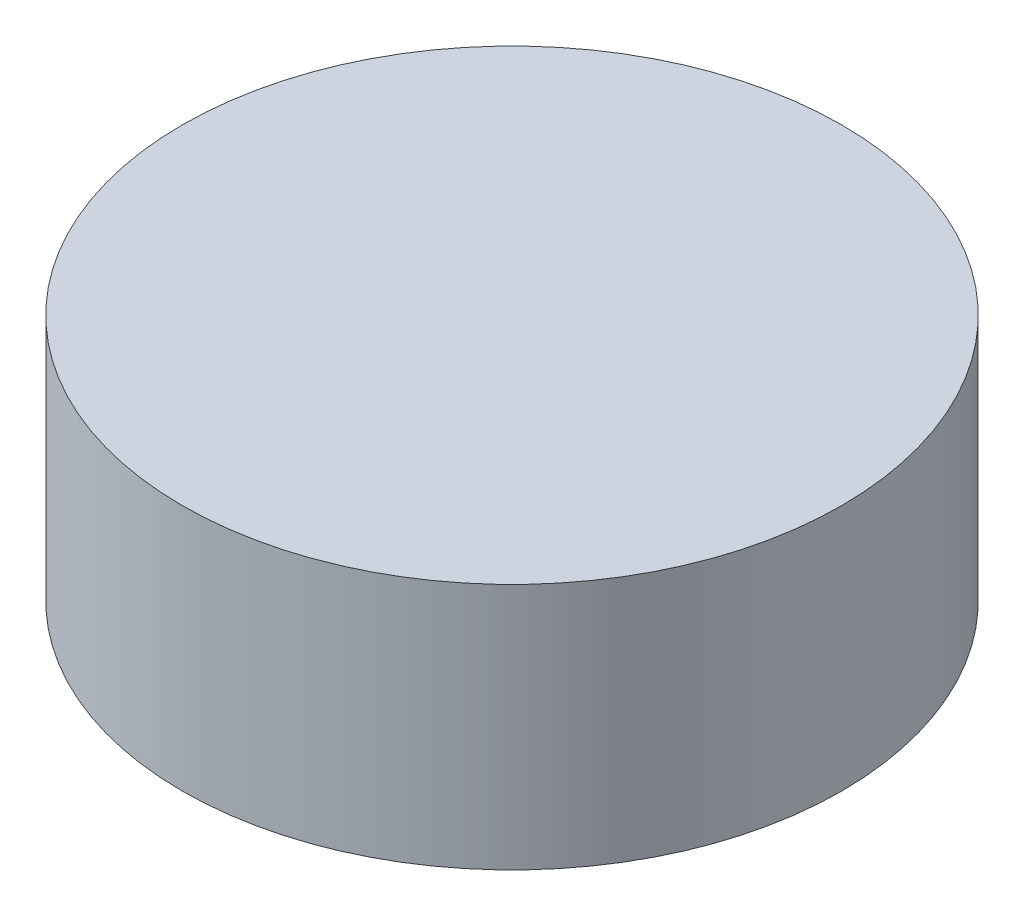
from build123d import *

# Parameters (mm, degrees)
SKETCH2_R                 = 50.8
BOSS_EXTRUDE1_DEPTH       = 38.1
FUEL_D                    = 1.016
FUEL_DEPTH                = 25.4
FUELPATTERN_COPY_1_D      = 1.016
FUELPATTERN_COPY_1_DEPTH  = 25.4
FUELPATTERN_COPY_2_D      = 1.016
FUELPATTERN_COPY_2_DEPTH  = 25.4
FUELPATTERN_COPY_3_D      = 1.016
FUELPATTERN_COPY_3_DEPTH  = 25.4
FUELPATTERN_COPY_4_D      = 1.016
FUELPATTERN_COPY_4_DEPTH  = 25.4
FUELPATTERN_COPY_5_D      = 1.016
FUELPATTERN_COPY_5_DEPTH  = 25.4
FUELPATTERN_COPY_6_D      = 1.016
FUELPATTERN_COPY_6_DEPTH  = 25.4
FUELPATTERN_COPY_7_D      = 1.016
FUELPATTERN_COPY_7_DEPTH  = 25.4
FUELPATTERN_COPY_8_D      = 1.016
FUELPATTERN_COPY_8_DEPTH  = 25.4
FUELPATTERN_COPY_9_D      = 1.016
FUELPATTERN_COPY_9_DEPTH  = 25.4
FUELPATTERN_COPY_10_D     = 1.016
FUELPATTERN_COPY_10_DEPTH = 25.4
OX_D                      = 1.016
OX_DEPTH                  = 25.4
OXPATTERN_COPY_1_D        = 1.016
OXPATTERN_COPY_1_DEPTH    = 25.4
OXPATTERN_COPY_2_D        = 1.016
OXPATTERN_COPY_2_DEPTH    = 25.4
OXPATTERN_COPY_3_D        = 1.016
OXPATTERN_COPY_3_DEPTH    = 25.4
OXPATTERN_COPY_4_D        = 1.016
OXPATTERN_COPY_4_DEPTH    = 25.4
OXPATTERN_COPY_5_D        = 1.016
OXPATTERN_COPY_5_DEPTH    = 25.4
OXPATTERN_COPY_6_D        = 1.016
OXPATTERN_COPY_6_DEPTH    = 25.4


with BuildPart() as part:
    # Sketch2 → Boss-Extrude1 (new body)
    with BuildSketch(Plane(origin=(0, 0, 0), x_dir=(1, 0, 0), z_dir=(0, 1, 0))):
        Circle(SKETCH2_R)
    extrude(amount=BOSS_EXTRUDE1_DEPTH)

    # Fuel
    with Locations(Plane(origin=(0, 0, 0), x_dir=(0, 0, -1), z_dir=(-0.7071067811865488, -0.7071067811865464, 0))):
        with Locations((-38.1, 4.490128061)):
            fuel = Hole(FUEL_D / 2, depth=FUEL_DEPTH)

    # FuelMirror: Fuel across plane
    add(fuel.mirror(Plane(origin=(0, 0, 0), x_dir=(0, 0, 1), z_dir=(1, 0, 0))), mode=Mode.SUBTRACT)

    # FuelPattern copy 1
    with Locations(Plane(origin=(0, 0, 0), x_dir=(-0.8660254037844386, 0, -0.5000000000000001), z_dir=(0.35355339059327445, -0.7071067811865464, -0.6123724356957956))):
        with Locations((-38.1, -4.490128061)):
            Hole(FUELPATTERN_COPY_1_D / 2, depth=FUELPATTERN_COPY_1_DEPTH)

    # FuelPattern copy 2
    with Locations(Plane(origin=(0, 0, 0), x_dir=(-0.8660254037844387, 0, 0.4999999999999998), z_dir=(-0.35355339059327423, -0.7071067811865464, -0.6123724356957957))):
        with Locations((-38.1, -4.490128061)):
            Hole(FUELPATTERN_COPY_2_D / 2, depth=FUELPATTERN_COPY_2_DEPTH)

    # FuelPattern copy 3
    with Locations(Plane(origin=(0, 0, 0), x_dir=(0, 0, 1), z_dir=(-0.7071067811865488, -0.7071067811865464, 0))):
        with Locations((-38.1, -4.490128061)):
            Hole(FUELPATTERN_COPY_3_D / 2, depth=FUELPATTERN_COPY_3_DEPTH)

    # FuelPattern copy 4
    with Locations(Plane(origin=(0, 0, 0), x_dir=(0.8660254037844384, 0, 0.5000000000000004), z_dir=(-0.35355339059327473, -0.7071067811865464, 0.6123724356957955))):
        with Locations((-38.1, -4.490128061)):
            Hole(FUELPATTERN_COPY_4_D / 2, depth=FUELPATTERN_COPY_4_DEPTH)

    # FuelPattern copy 5
    with Locations(Plane(origin=(0, 0, 0), x_dir=(0.8660254037844386, 0, -0.5000000000000001), z_dir=(0.35355339059327445, -0.7071067811865464, 0.6123724356957956))):
        with Locations((-38.1, -4.490128061)):
            Hole(FUELPATTERN_COPY_5_D / 2, depth=FUELPATTERN_COPY_5_DEPTH)

    # FuelPattern copy 6
    with Locations(Plane(origin=(0, 0, 0), x_dir=(-0.8660254037844386, 0, -0.5000000000000001), z_dir=(-0.35355339059327445, -0.7071067811865464, 0.6123724356957956))):
        with Locations((-38.1, 4.490128061)):
            Hole(FUELPATTERN_COPY_6_D / 2, depth=FUELPATTERN_COPY_6_DEPTH)

    # FuelPattern copy 7
    with Locations(Plane(origin=(0, 0, 0), x_dir=(-0.8660254037844387, 0, 0.4999999999999998), z_dir=(0.35355339059327423, -0.7071067811865464, 0.6123724356957957))):
        with Locations((-38.1, 4.490128061)):
            Hole(FUELPATTERN_COPY_7_D / 2, depth=FUELPATTERN_COPY_7_DEPTH)

    # FuelPattern copy 8
    with Locations(Plane(origin=(0, 0, 0), x_dir=(0, 0, 1), z_dir=(0.7071067811865488, -0.7071067811865464, 0))):
        with Locations((-38.1, 4.490128061)):
            Hole(FUELPATTERN_COPY_8_D / 2, depth=FUELPATTERN_COPY_8_DEPTH)

    # FuelPattern copy 9
    with Locations(Plane(origin=(0, 0, 0), x_dir=(0.8660254037844384, 0, 0.5000000000000004), z_dir=(0.35355339059327473, -0.7071067811865464, -0.6123724356957955))):
        with Locations((-38.1, 4.490128061)):
            Hole(FUELPATTERN_COPY_9_D / 2, depth=FUELPATTERN_COPY_9_DEPTH)

    # FuelPattern copy 10
    with Locations(Plane(origin=(0, 0, 0), x_dir=(0.8660254037844386, 0, -0.5000000000000001), z_dir=(-0.35355339059327445, -0.7071067811865464, -0.6123724356957956))):
        with Locations((-38.1, 4.490128061)):
            Hole(FUELPATTERN_COPY_10_D / 2, depth=FUELPATTERN_COPY_10_DEPTH)

    # Ox
    with Locations(Plane(origin=(0, 0, 0), x_dir=(0, 0, -1), z_dir=(-0.7071067811865488, -0.7071067811865464, 0))):
        with Locations((-12.7, 4.490128061)):
            ox = Hole(OX_D / 2, depth=OX_DEPTH)

    # OxMirror: Ox across plane
    add(ox.mirror(Plane(origin=(0, 0, 0), x_dir=(0, 0, 1), z_dir=(1, 0, 0))), mode=Mode.SUBTRACT)

    # OxPattern copy 1
    with Locations(Plane(origin=(0, 0, 0), x_dir=(-1, 0, 0), z_dir=(0, -0.7071067811865464, -0.7071067811865488))):
        with Locations((-12.7, -4.490128061)):
            Hole(OXPATTERN_COPY_1_D / 2, depth=OXPATTERN_COPY_1_DEPTH)

    # OxPattern copy 2
    with Locations(Plane(origin=(0, 0, 0), x_dir=(0, 0, 1), z_dir=(-0.7071067811865488, -0.7071067811865464, 0))):
        with Locations((-12.7, -4.490128061)):
            Hole(OXPATTERN_COPY_2_D / 2, depth=OXPATTERN_COPY_2_DEPTH)

    # OxPattern copy 3
    with Locations(Plane(origin=(0, 0, 0), x_dir=(1, 0, 0), z_dir=(0, -0.7071067811865464, 0.7071067811865488))):
        with Locations((-12.7, -4.490128061)):
            Hole(OXPATTERN_COPY_3_D / 2, depth=OXPATTERN_COPY_3_DEPTH)

    # OxPattern copy 4
    with Locations(Plane(origin=(0, 0, 0), x_dir=(-1, 0, 0), z_dir=(0, -0.7071067811865464, 0.7071067811865488))):
        with Locations((-12.7, 4.490128061)):
            Hole(OXPATTERN_COPY_4_D / 2, depth=OXPATTERN_COPY_4_DEPTH)

    # OxPattern copy 5
    with Locations(Plane(origin=(0, 0, 0), x_dir=(0, 0, 1), z_dir=(0.7071067811865488, -0.7071067811865464, 0))):
        with Locations((-12.7, 4.490128061)):
            Hole(OXPATTERN_COPY_5_D / 2, depth=OXPATTERN_COPY_5_DEPTH)

    # OxPattern copy 6
    with Locations(Plane(origin=(0, 0, 0), x_dir=(1, 0, 0), z_dir=(0, -0.7071067811865464, -0.7071067811865488))):
        with Locations((-12.7, 4.490128061)):
            Hole(OXPATTERN_COPY_6_D / 2, depth=OXPATTERN_COPY_6_DEPTH)


solid = part.part
